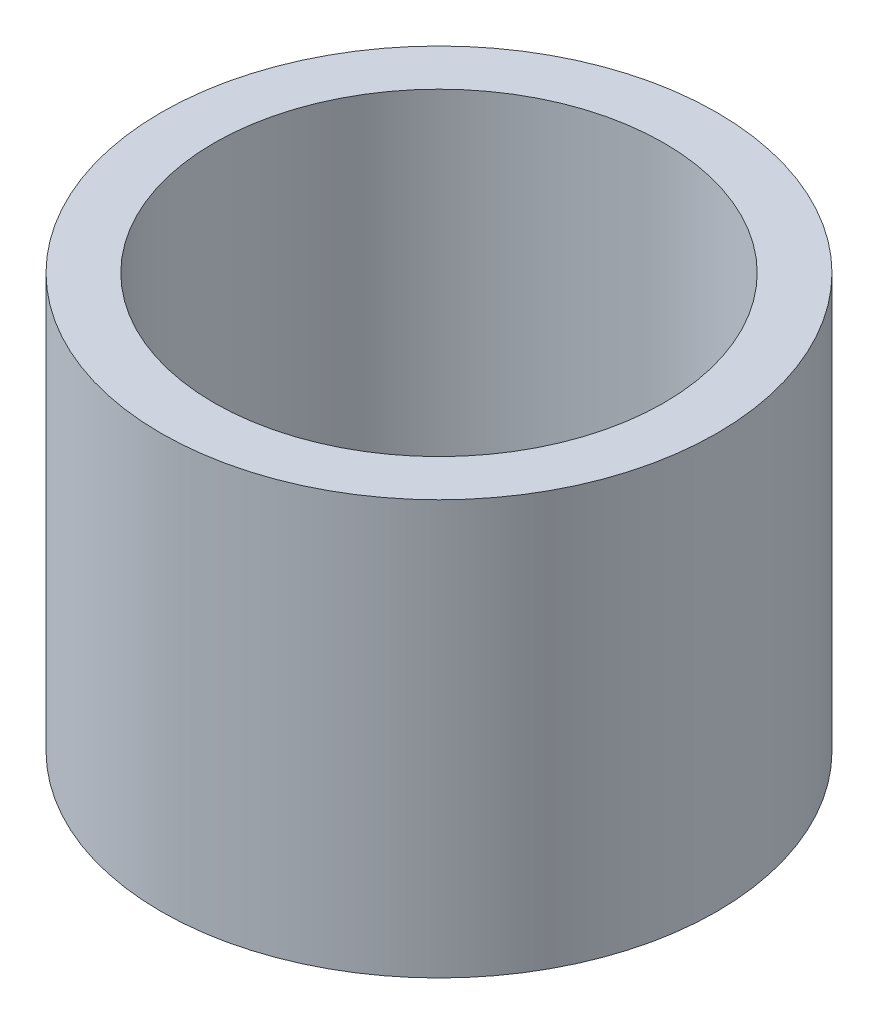
from build123d import *

# Parameters (mm, degrees)
SKETCH1_R      = 51.1302
SKETCH1_R_2    = 41.402
ABLATIVE_DEPTH = 76.2


with BuildPart() as part:
    # Sketch1 → Ablative (new body)
    with BuildSketch(Plane(origin=(0, 0, 0), x_dir=(1, 0, 0), z_dir=(0, 1, 0))):
        Circle(SKETCH1_R)
        Circle(SKETCH1_R_2, mode=Mode.SUBTRACT)
    extrude(amount=-ABLATIVE_DEPTH)


solid = part.part
